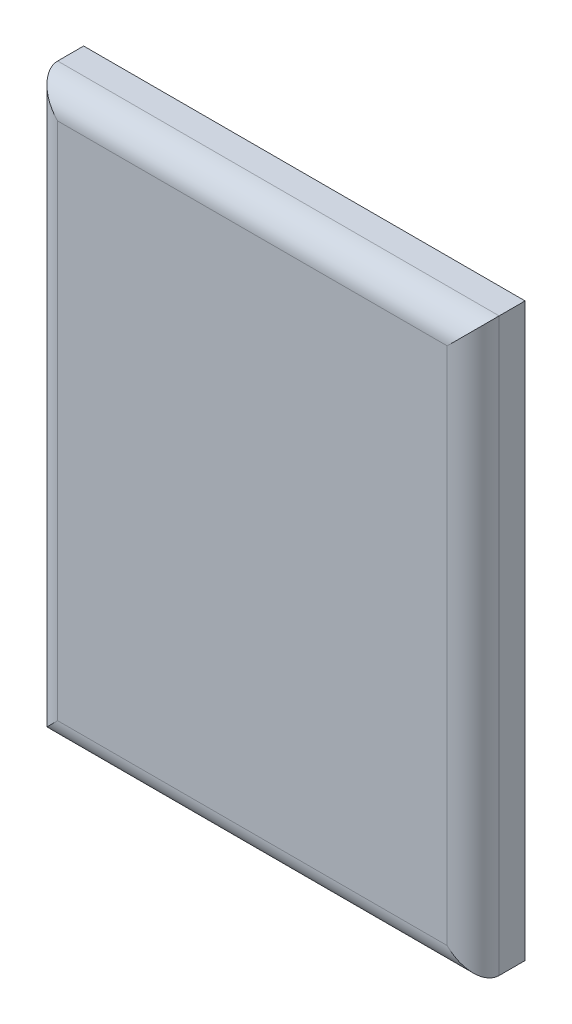
from build123d import *

# Parameters (mm, degrees)
SKETCH2_W           = 170
SKETCH2_H           = 220
BOSS_EXTRUDE1_DEPTH = 50
FILLET1_R           = 10
SKETCH3_W           = 150
SKETCH3_H           = 200
CUT_EXTRUDE1_DEPTH  = 50
SKETCH6_W           = 150
SKETCH6_H           = 200
BOSS_EXTRUDE2_DEPTH = 10
SKETCH7_W           = 170
SKETCH7_H           = 220
CUT_EXTRUDE3_DEPTH  = 30


with BuildPart() as part:
    # Sketch2 → Boss-Extrude1 (new body)
    with BuildSketch(Plane.XY):
        with Locations((33.670212766, 79.813829787)):
            Rectangle(SKETCH2_W, SKETCH2_H)
    extrude(amount=BOSS_EXTRUDE1_DEPTH)

    # Fillet1
    fillet1_edges = [part.edges().sort_by_distance(p)[0] for p in [
        (118.670212766, 79.813829787, 50),
        (33.670212766, 189.813829787, 50),
        (-51.329787234, 79.813829787, 50),
        (33.670212766, -30.186170213, 50),
    ]]
    fillet(fillet1_edges, radius=FILLET1_R)

    # Sketch3 → Cut-Extrude1 (cut)
    with BuildSketch(Plane(origin=(0, 0, 0), x_dir=(-1, 0, 0), z_dir=(0, 0, -1))):
        with Locations((-33.670212766, 79.813829787)):
            Rectangle(SKETCH3_W, SKETCH3_H)
    extrude(amount=-CUT_EXTRUDE1_DEPTH, mode=Mode.SUBTRACT)

    # Sketch6 → Boss-Extrude2 (add)
    with BuildSketch(Plane.XY.offset(40)):
        with Locations((33.670212766, 79.813829787)):
            Rectangle(SKETCH6_W, SKETCH6_H)
    extrude(amount=BOSS_EXTRUDE2_DEPTH)

    # Sketch7 → Cut-Extrude3 (cut)
    with BuildSketch(Plane.XY):
        with Locations((33.670212766, 79.813829787)):
            Rectangle(SKETCH7_W, SKETCH7_H)
    extrude(amount=CUT_EXTRUDE3_DEPTH, mode=Mode.SUBTRACT)


solid = part.part
